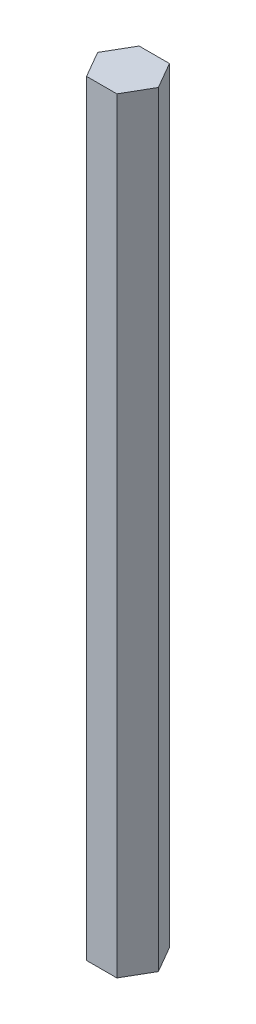
from build123d import *

# Parameters (mm, degrees)
SALIENTE_EXTRUIR1_DEPTH = 185


with BuildPart() as part:
    # Croquis1 → Saliente-Extruir1 (new body)
    with BuildSketch(Plane(origin=(0, 0, 0), x_dir=(1, 0, 0), z_dir=(0, 1, 0))):
        Polygon((7.332348419, 0), (3.666174209, 6.35), (-3.666174209, 6.35), (-7.332348419, 0), (-3.666174209, -6.35), (3.666174209, -6.35), align=None)
    extrude(amount=SALIENTE_EXTRUIR1_DEPTH)


solid = part.part
